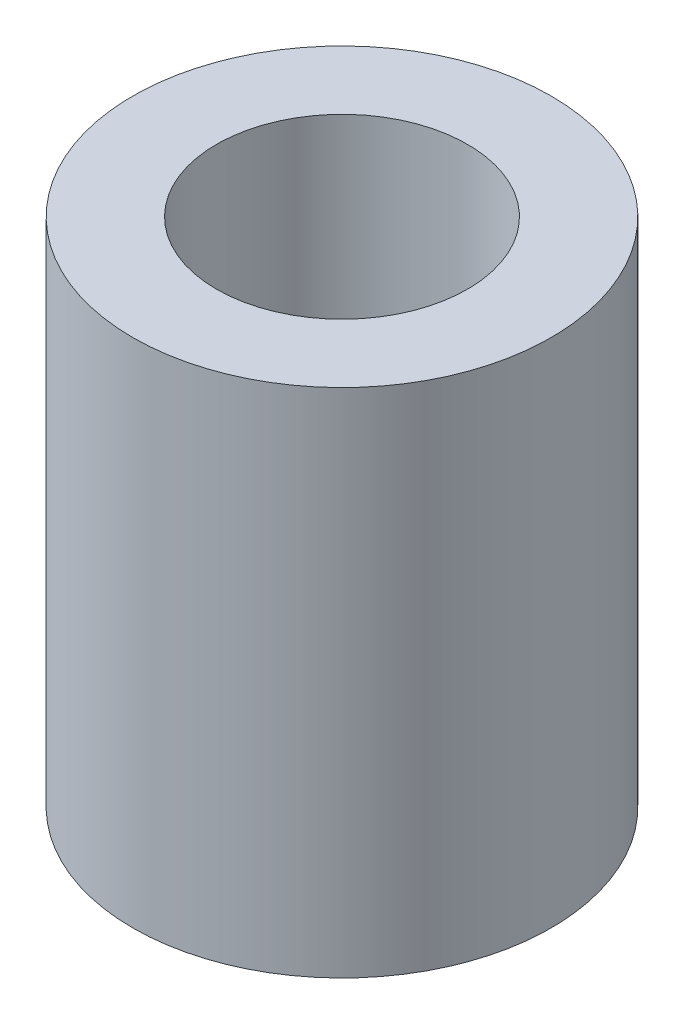
from build123d import *

# Parameters (mm, degrees)
SKETCH1_R           = 20
SKETCH1_R_2         = 12
BOSS_EXTRUDE1_DEPTH = 48.89


with BuildPart() as part:
    # Sketch1 → Boss-Extrude1 (new body)
    with BuildSketch(Plane(origin=(0, 0, 0), x_dir=(1, 0, 0), z_dir=(0, 1, 0))):
        with Locations(Location((0, 0, 0), (0, 0, 270))):
            Circle(SKETCH1_R)
        with Locations(Location((0, 0, 0), (0, 0, 270))):
            Circle(SKETCH1_R_2, mode=Mode.SUBTRACT)
    extrude(amount=BOSS_EXTRUDE1_DEPTH)


solid = part.part
